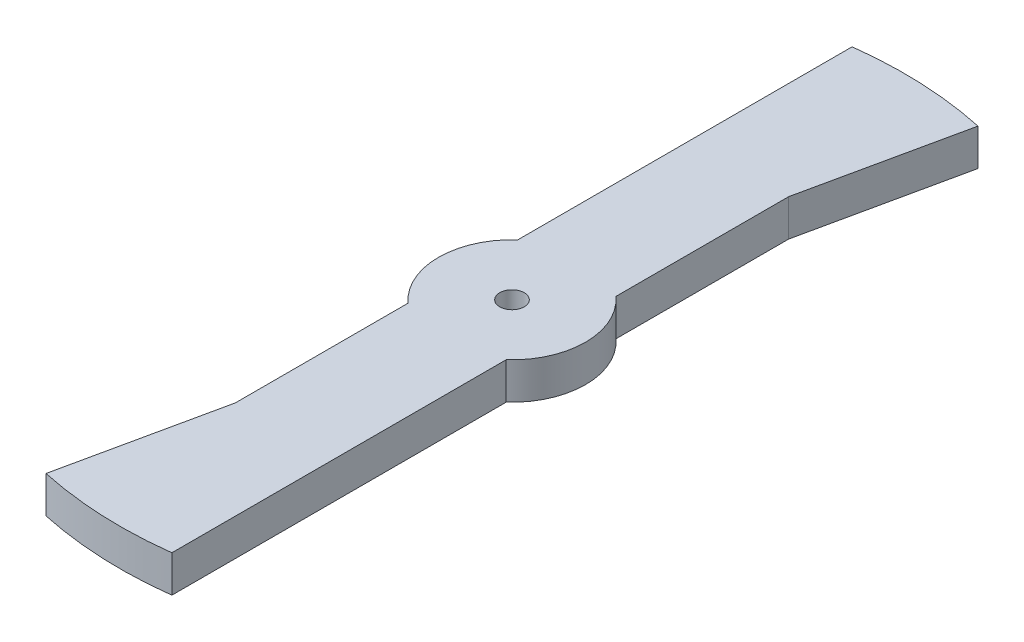
from build123d import *

# Parameters (mm, degrees)
SKETCH1_R           = 3.175
BOSS_EXTRUDE1_DEPTH = 9.525


with BuildPart() as part:
    # Sketch1 → Boss-Extrude1 (new body)
    with BuildSketch(Plane(origin=(0, 0, 0), x_dir=(1, 0, 0), z_dir=(0, 1, 0))):
        with BuildLine():
            ThreePointArc((12.7, 14.199031657), (19.05, 0), (12.7, -14.199031657))
            Line((12.7, -14.199031657), (12.7, -100.803124952))
            ThreePointArc((12.7, -100.803124952), (-4.407318933, -101.504362171), (-21.389473684, -99.322960163))
            Line((-21.389473684, -99.322960163), (-12.7, -58.973007597))
            Line((-12.7, -58.973007597), (-12.7, -14.199031657))
            ThreePointArc((-12.7, -14.199031657), (-19.05, 0), (-12.7, 14.199031657))
            Line((-12.7, 14.199031657), (-12.7, 100.803124952))
            ThreePointArc((-12.7, 100.803124952), (4.407318933, 101.504362171), (21.389473684, 99.322960163))
            Line((21.389473684, 99.322960163), (12.7, 58.973007597))
            Line((12.7, 58.973007597), (12.7, 14.199031657))
        make_face()
        with Locations(Location((0, 0, 0), (0, 0, 90))):
            Circle(SKETCH1_R, mode=Mode.SUBTRACT)
    extrude(amount=BOSS_EXTRUDE1_DEPTH)


solid = part.part
